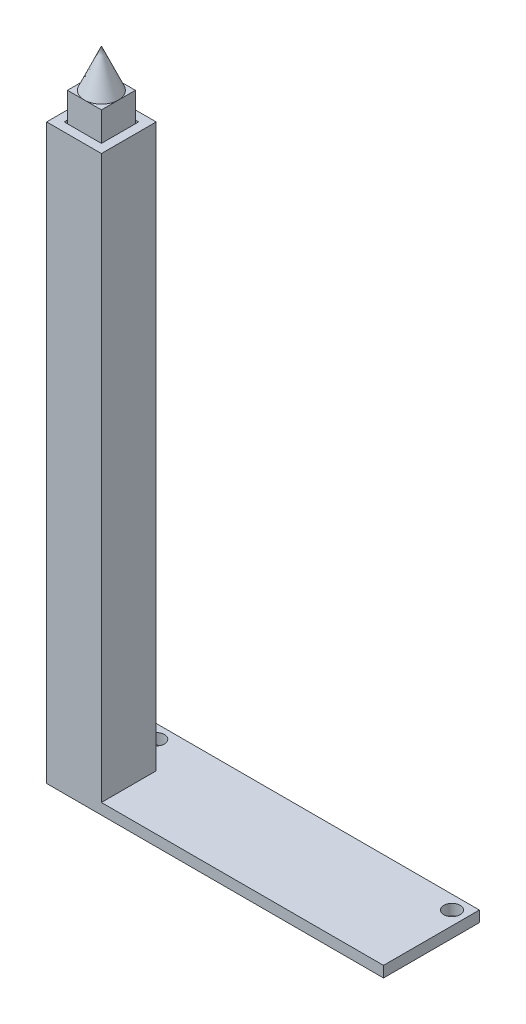
from build123d import *

# Parameters (mm, degrees)
SKETCH1_R            = 1.5
SKETCH1_W            = 10
SKETCH1_H            = 10
SKETCH1_W_2          = 8
SKETCH1_H_2          = 8
BOSS_EXTRUDE5_DEPTH  = 2
SKETCH1_5_W          = 10
SKETCH1_5_H          = 10
SKETCH1_5_W_2        = 8
SKETCH1_5_H_2        = 8
BOSS_EXTRUDE6_DEPTH  = 101.6
SKETCH8_W            = 10
SKETCH8_H            = 10
SKETCH8_W_2          = 8
SKETCH8_H_2          = 8
SKETCH8_W_3          = 6.8
SKETCH8_H_3          = 6.8
BOSS_EXTRUDE11_DEPTH = 3
SKETCH9_W            = 7.4
SKETCH9_H            = 7.4
BOSS_EXTRUDE12_DEPTH = 3
SKETCH10_W           = 6.2
SKETCH10_H           = 6.2
BOSS_EXTRUDE13_DEPTH = 106.6


with BuildPart() as part:
    # Sketch1 → Boss-Extrude5 (new body)
    # profile 1 of 2: a face of its own
    with BuildSketch(Plane(origin=(0, 0, 0), x_dir=(1, 0, 0), z_dir=(0, 1, 0))):
        Polygon((-20.75, -8.75), (30.75, -8.75), (30.75, 8.75), (-30.75, 8.75), (-30.75, 1.25), (-20.75, 1.25), align=None)
        with Locations(Location((-25.75, 6.25, 0), (0, 0, 270))):
            Circle(SKETCH1_R, mode=Mode.SUBTRACT)
        with Locations(Location((28.25, 6.25, 0), (0, 0, 270))):
            Circle(SKETCH1_R, mode=Mode.SUBTRACT)
    # profile 2 of 2: a face of its own
    with BuildSketch(Plane(origin=(0, 0, 0), x_dir=(1, 0, 0), z_dir=(0, 1, 0))):
        with Locations((-25.75, -3.75)):
            Rectangle(SKETCH1_W, SKETCH1_H)
        with Locations((-25.75, -3.75)):
            Rectangle(SKETCH1_W_2, SKETCH1_H_2, mode=Mode.SUBTRACT)
    extrude(amount=BOSS_EXTRUDE5_DEPTH)

    # Sketch1<5> → Boss-Extrude6 (add)
    with BuildSketch(Plane(origin=(0, 0, 0), x_dir=(1, 0, 0), z_dir=(0, 1, 0))):
        with Locations((-25.75, -3.75)):
            Rectangle(SKETCH1_5_W, SKETCH1_5_H)
        with Locations((-25.75, -3.75)):
            Rectangle(SKETCH1_5_W_2, SKETCH1_5_H_2, mode=Mode.SUBTRACT)
    extrude(amount=BOSS_EXTRUDE6_DEPTH)

    # Sketch8 → Boss-Extrude11 (add)
    # profile 1 of 2: a face of its own
    with BuildSketch(Plane(origin=(0, 101.6, 0), x_dir=(1, 0, 0), z_dir=(0, 1, 0))):
        with Locations((-25.75, -3.75)):
            Rectangle(SKETCH8_W, SKETCH8_H)
        with Locations((-25.75, -3.75)):
            Rectangle(SKETCH8_W_2, SKETCH8_H_2, mode=Mode.SUBTRACT)
    # profile 2 of 2: a face of its own
    with BuildSketch(Plane(origin=(0, 101.6, 0), x_dir=(1, 0, 0), z_dir=(0, 1, 0))):
        with Locations((-25.75, -3.75)):
            Rectangle(SKETCH8_W_2, SKETCH8_H_2)
        with Locations((-25.75, -3.75)):
            Rectangle(SKETCH8_W_3, SKETCH8_H_3, mode=Mode.SUBTRACT)
    extrude(amount=BOSS_EXTRUDE11_DEPTH)


with BuildPart() as body_2:
    # Sketch9 → Boss-Extrude12 (new body)
    with BuildSketch(Plane.XZ):
        with Locations((-25.75, 3.75)):
            Rectangle(SKETCH9_W, SKETCH9_H)
    extrude(amount=-BOSS_EXTRUDE12_DEPTH)

    # Sketch10 → Boss-Extrude13 (add)
    with BuildSketch(Plane(origin=(0, 3, 0), x_dir=(1, 0, 0), z_dir=(0, 1, 0))):
        with Locations((-25.75, -3.75)):
            Rectangle(SKETCH10_W, SKETCH10_H)
    extrude(amount=BOSS_EXTRUDE13_DEPTH)

    # Sketch11 → Revolve2 (revolve)
    with BuildSketch(Plane(origin=(0, 0, 3.75), x_dir=(-1, 0, 0), z_dir=(0, 0, -1)), mode=Mode.PRIVATE) as revolve2_sk:
        Polygon((28.85, 109.6), (25.75, 116.6), (25.75, 109.6), align=None)
    revolve(revolve2_sk.sketch.rotate(Axis((-25.75, 116.6, 3.75), (0, -1, 0)), 90), axis=Axis((-25.75, 116.6, 3.75), (0, -1, 0)))


solid = Compound([part.part, body_2.part])
